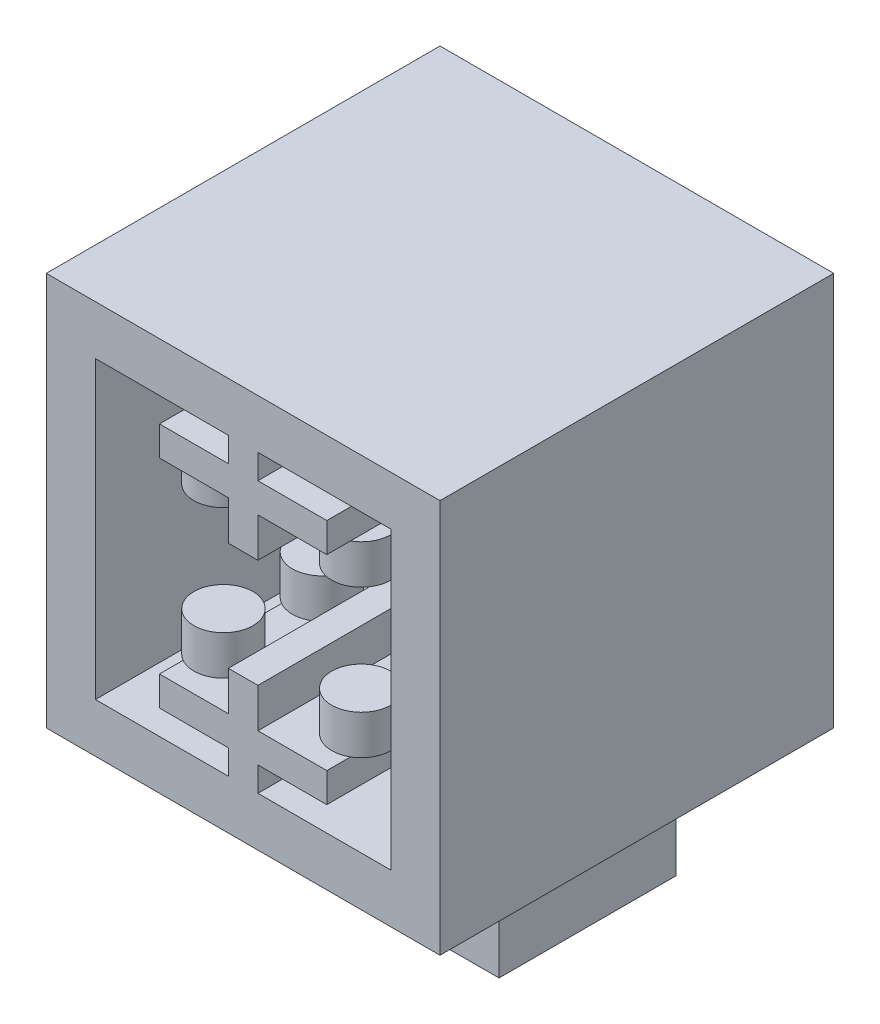
from build123d import *

# Parameters (mm, degrees)
SKETCH1_W           = 150
SKETCH1_H           = 90
BOSS_EXTRUDE1_DEPTH = 50
BOSS_EXTRUDE2_START = -100
SKETCH2_W           = 200
SKETCH2_H           = 200
BOSS_EXTRUDE2_DEPTH = 200
SKETCH3_W           = 150
SKETCH3_H           = 150
CUT_EXTRUDE1_DEPTH  = 200
SKETCH4_W           = 15
SKETCH4_H           = 15
SKETCH4_H_2         = 12.5
SKETCH4_W_2         = 35
BOSS_EXTRUDE3_DEPTH = 200
SKETCH6_W           = 15
SKETCH6_H           = 15
BOSS_EXTRUDE4_DEPTH = 200
SKETCH5_R           = 15
BOSS_EXTRUDE5_DEPTH = 95
SKETCH7_W           = 150
SKETCH7_H           = 55
CUT_EXTRUDE2_DEPTH  = 200


with BuildPart() as part:
    # Sketch1 → Boss-Extrude1 (new body)
    with BuildSketch(Plane(origin=(0, 0, 0), x_dir=(1, 0, 0), z_dir=(0, 1, 0))):
        Rectangle(SKETCH1_W, SKETCH1_H)
    extrude(amount=BOSS_EXTRUDE1_DEPTH)

    # Sketch2 → Boss-Extrude2 (add)
    with BuildSketch(Plane.XY.offset(BOSS_EXTRUDE2_START)):
        with Locations((0, 150)):
            Rectangle(SKETCH2_W, SKETCH2_H)
    extrude(amount=BOSS_EXTRUDE2_DEPTH)

    # Sketch3 → Cut-Extrude1 (cut)
    with BuildSketch(Plane.XY.offset(100)):
        with Locations((0, 150)):
            Rectangle(SKETCH3_W, SKETCH3_H)
    extrude(amount=-CUT_EXTRUDE1_DEPTH, mode=Mode.SUBTRACT)

    # Sketch4 → Boss-Extrude3 (add)
    with BuildSketch(Plane.XY.offset(100)):
        with Locations((0, 205)):
            Rectangle(SKETCH4_W, SKETCH4_H)
        with Locations((0, 218.75)):
            Rectangle(SKETCH4_W, SKETCH4_H_2)
        with Locations((-25, 205)):
            Rectangle(SKETCH4_W_2, SKETCH4_H)
        with Locations((25, 205)):
            Rectangle(SKETCH4_W_2, SKETCH4_H)
        with Locations((0, 191.25)):
            Rectangle(SKETCH4_W, SKETCH4_H_2)
        with Locations((0, 108.75)):
            Rectangle(SKETCH4_W, SKETCH4_H_2)
        with Locations((0, 95)):
            Rectangle(SKETCH4_W, SKETCH4_H)
        with Locations((0, 81.25)):
            Rectangle(SKETCH4_W, SKETCH4_H_2)
        with Locations((-25, 95)):
            Rectangle(SKETCH4_W_2, SKETCH4_H)
        with Locations((25, 95)):
            Rectangle(SKETCH4_W_2, SKETCH4_H)
    extrude(amount=-BOSS_EXTRUDE3_DEPTH)

    # Sketch6 → Boss-Extrude4 (add)
    with BuildSketch(Plane.XY.offset(100)):
        with Locations((0, 185)):
            Rectangle(SKETCH6_W, SKETCH6_H)
        with Locations((0, 115)):
            Rectangle(SKETCH6_W, SKETCH6_H)
    extrude(amount=-BOSS_EXTRUDE4_DEPTH)

    # Sketch5 → Boss-Extrude5 (add)
    with BuildSketch(Plane.XZ.offset(-197.5)):
        with Locations(Location((35, 75, 0), (0, 0, 60))):
            Circle(SKETCH5_R)
        with Locations(Location((35, 25, 0), (0, 0, 60))):
            Circle(SKETCH5_R)
        with Locations(Location((35, -25, 0), (0, 0, 60))):
            Circle(SKETCH5_R)
        with Locations(Location((35, -75, 0), (0, 0, 60))):
            Circle(SKETCH5_R)
        with Locations(Location((-35, 75, 0), (0, 0, 120))):
            Circle(SKETCH5_R)
        with Locations(Location((-35, 25, 0), (0, 0, 120))):
            Circle(SKETCH5_R)
        with Locations(Location((-35, -25, 0), (0, 0, 120))):
            Circle(SKETCH5_R)
        with Locations(Location((-35, -75, 0), (0, 0, 120))):
            Circle(SKETCH5_R)
    extrude(amount=BOSS_EXTRUDE5_DEPTH)

    # Sketch7 → Cut-Extrude2 (cut)
    with BuildSketch(Plane.XY.offset(100)):
        with Locations((0, 150)):
            Rectangle(SKETCH7_W, SKETCH7_H)
    extrude(amount=-CUT_EXTRUDE2_DEPTH, mode=Mode.SUBTRACT)


solid = part.part
